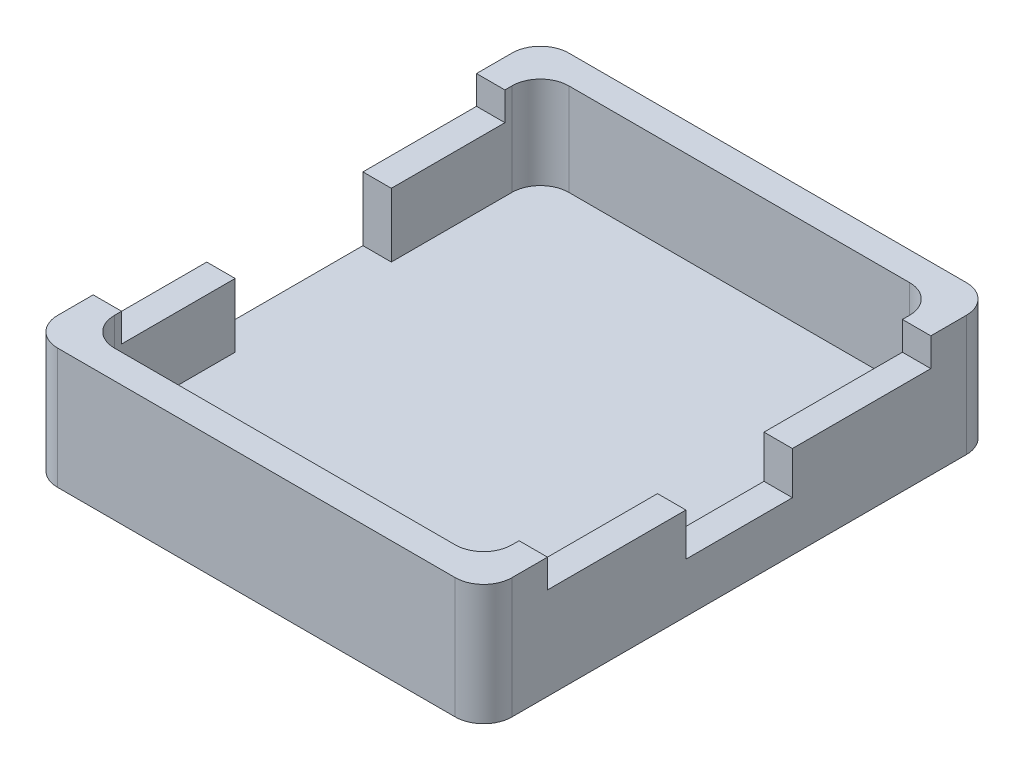
from build123d import *

# Parameters (mm, degrees)
SKETCH1_W           = 32
SKETCH1_H           = 36
BOSS_EXTRUDE1_DEPTH = 2
SKETCH2_W           = 32
SKETCH2_H           = 36
SKETCH2_W_2         = 28
SKETCH2_H_2         = 32
BOSS_EXTRUDE2_DEPTH = 6.5
CUT_EXTRUDE1_DEPTH  = 2
CUT_EXTRUDE2_DEPTH  = 2
FILLET1_R           = 2


with BuildPart() as part:
    # Sketch1 → Boss-Extrude1 (new body)
    with BuildSketch(Plane(origin=(0, 0, 0), x_dir=(1, 0, 0), z_dir=(0, 1, 0))):
        Rectangle(SKETCH1_W, SKETCH1_H)
    extrude(amount=BOSS_EXTRUDE1_DEPTH)

    # Sketch2 → Boss-Extrude2 (add)
    with BuildSketch(Plane(origin=(0, 2, 0), x_dir=(1, 0, 0), z_dir=(0, 1, 0))):
        Rectangle(SKETCH2_W, SKETCH2_H)
        Rectangle(SKETCH2_W_2, SKETCH2_H_2, mode=Mode.SUBTRACT)
    extrude(amount=BOSS_EXTRUDE2_DEPTH)

    # Sketch3 → Cut-Extrude1 (cut)
    with BuildSketch(Plane.ZY.offset(16)):
        Polygon((-13.5, 8.5), (-13.5, 6.5), (-5.5, 6.5), (-5.5, 2), (5.5, 2), (5.5, 6.5), (13.5, 6.5), (13.5, 8.5), align=None)
    extrude(amount=-CUT_EXTRUDE1_DEPTH, mode=Mode.SUBTRACT)

    # Sketch4 → Cut-Extrude2 (cut)
    with BuildSketch(Plane(origin=(16, 0, 0), x_dir=(0, 0, -1), z_dir=(1, 0, 0))):
        Polygon((-13.5, 8.5), (-13.5, 6.5), (-3.75, 6.5), (-3.75, 3.5), (3.75, 3.5), (3.75, 6.5), (13.5, 6.5), (13.5, 8.5), align=None)
    extrude(amount=-CUT_EXTRUDE2_DEPTH, mode=Mode.SUBTRACT)

    # Fillet1
    fillet1_edges = [part.edges().sort_by_distance(p)[0] for p in [
        (14, 5.25, -16),
        (14, 5.25, 16),
        (-14, 5.25, 16),
        (-14, 5.25, -16),
        (16, 4.25, 18),
        (-16, 4.25, 18),
        (-16, 4.25, -18),
        (16, 4.25, -18),
    ]]
    fillet(fillet1_edges, radius=FILLET1_R)


solid = part.part
